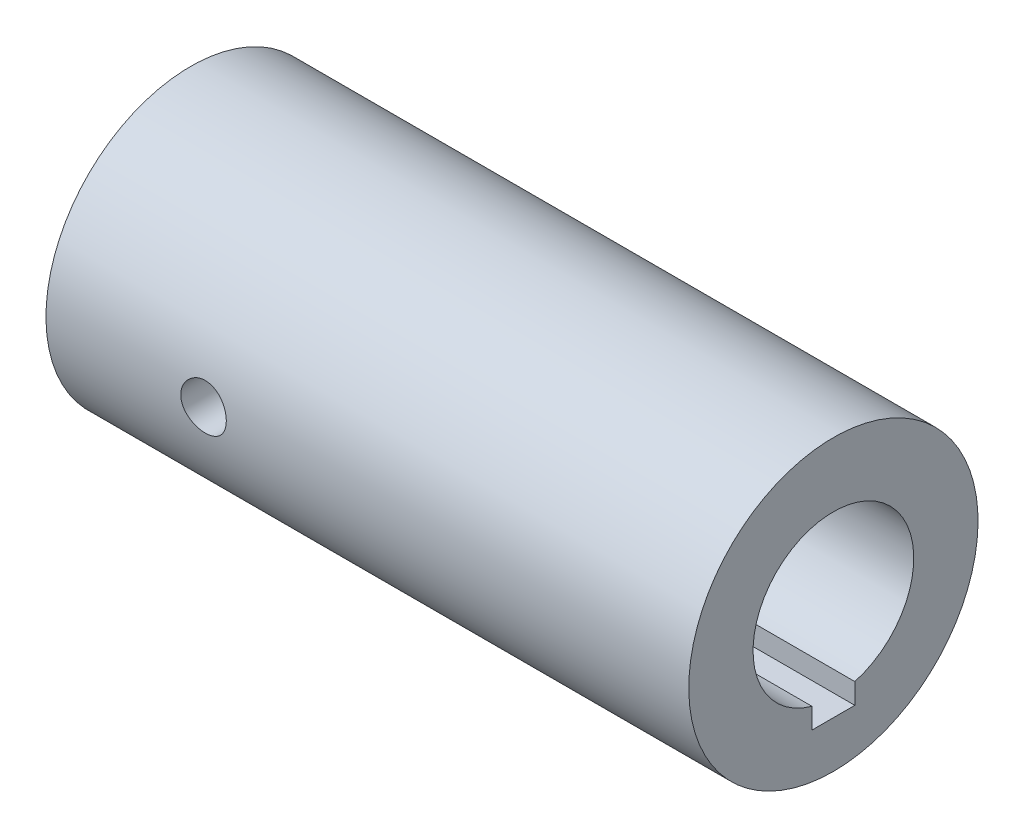
from build123d import *

# Parameters (mm, degrees)
IZIM1_W               = 120
IZIM1_H               = 12
IZIM2_W               = 120
IZIM2_H               = 8
KES_EKSTR_ZYON1_DEPTH = 18.3


with BuildPart() as part:
    # Çizim1 → Döndür1 (revolve)
    with BuildSketch(Plane.XY, mode=Mode.PRIVATE) as d_nd_r1_sk:
        with Locations((0, 21)):
            Rectangle(IZIM1_W, IZIM1_H)
    revolve(d_nd_r1_sk.sketch.rotate(Axis((-60, 0, 0), (1, 0, 0)), 180), axis=Axis((-60, 0, 0), (1, 0, 0)))

    # Çizim2 → Kes-Ekstrüzyon1 (cut)
    with BuildSketch(Plane(origin=(0, 0, 0), x_dir=(1, 0, 0), z_dir=(0, 1, 0))):
        Rectangle(IZIM2_W, IZIM2_H)
    extrude(amount=-KES_EKSTR_ZYON1_DEPTH, mode=Mode.SUBTRACT)

    # Çizim7 → M10 Dişli Delik4 (revolve, cut)
    with BuildSketch(Plane(origin=(-30.584904592, 0, -30), x_dir=(0, 1, 0), z_dir=(1, 0, 0))):
        Polygon((0, 0), (0, 37.113657631), (4.25, 34.56), (4.25, 0.775), (5.025, 0), align=None)
    m10_di_li_delik4 = revolve(axis=Axis((-30.584904592, 0, -36.35), (0, 0, 1)), mode=Mode.SUBTRACT)

    # Aynalama1: M10 Dişli Delik4 across plane
    add(m10_di_li_delik4.mirror(Plane.XY), mode=Mode.SUBTRACT)


solid = part.part
